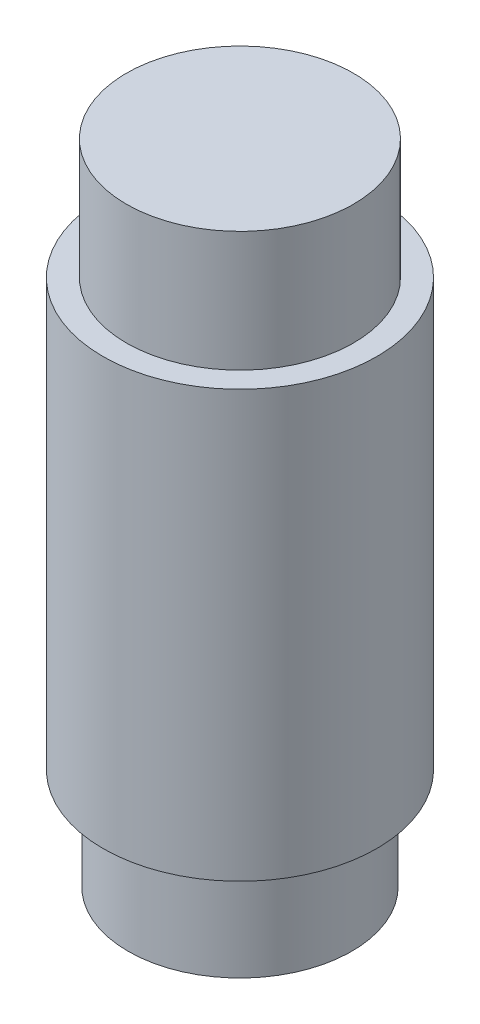
from build123d import *

# Parameters (mm, degrees)
SKETCH1_R           = 10.25
BOSS_EXTRUDE1_DEPTH = 31.9
SKETCH2_R           = 8.5
BOSS_EXTRUDE2_DEPTH = 4
SKETCH3_R           = 8.375
BOSS_EXTRUDE3_DEPTH = 7.6
SKETCH6_R           = 8.5
BOSS_EXTRUDE4_DEPTH = 9


with BuildPart() as part:
    # Sketch1 → Boss-Extrude1 (new body)
    with BuildSketch(Plane(origin=(0, 0, 0), x_dir=(1, 0, 0), z_dir=(0, 1, 0))):
        with Locations(Location((0, 0, 0), (0, 0, 270))):
            Circle(SKETCH1_R)
    extrude(amount=BOSS_EXTRUDE1_DEPTH)

    # Sketch2 → Boss-Extrude2 (add)
    with BuildSketch(Plane(origin=(0, 31.9, 0), x_dir=(1, 0, 0), z_dir=(0, 1, 0))):
        with Locations(Location((0, 0, 0), (0, 0, 270))):
            Circle(SKETCH2_R)
    extrude(amount=BOSS_EXTRUDE2_DEPTH)

    # Sketch3 → Boss-Extrude3 (add)
    with BuildSketch(Plane.XZ):
        with Locations(Location((0, 0, 0), (0, 0, 90))):
            Circle(SKETCH3_R)
    extrude(amount=BOSS_EXTRUDE3_DEPTH)

    # Sketch6 → Boss-Extrude4 (add)
    with BuildSketch(Plane(origin=(0, 31.9, 0), x_dir=(1, 0, 0), z_dir=(0, 1, 0))):
        with Locations(Location((0, 0, 0), (0, 0, 270))):
            Circle(SKETCH6_R)
    extrude(amount=BOSS_EXTRUDE4_DEPTH)


solid = part.part
